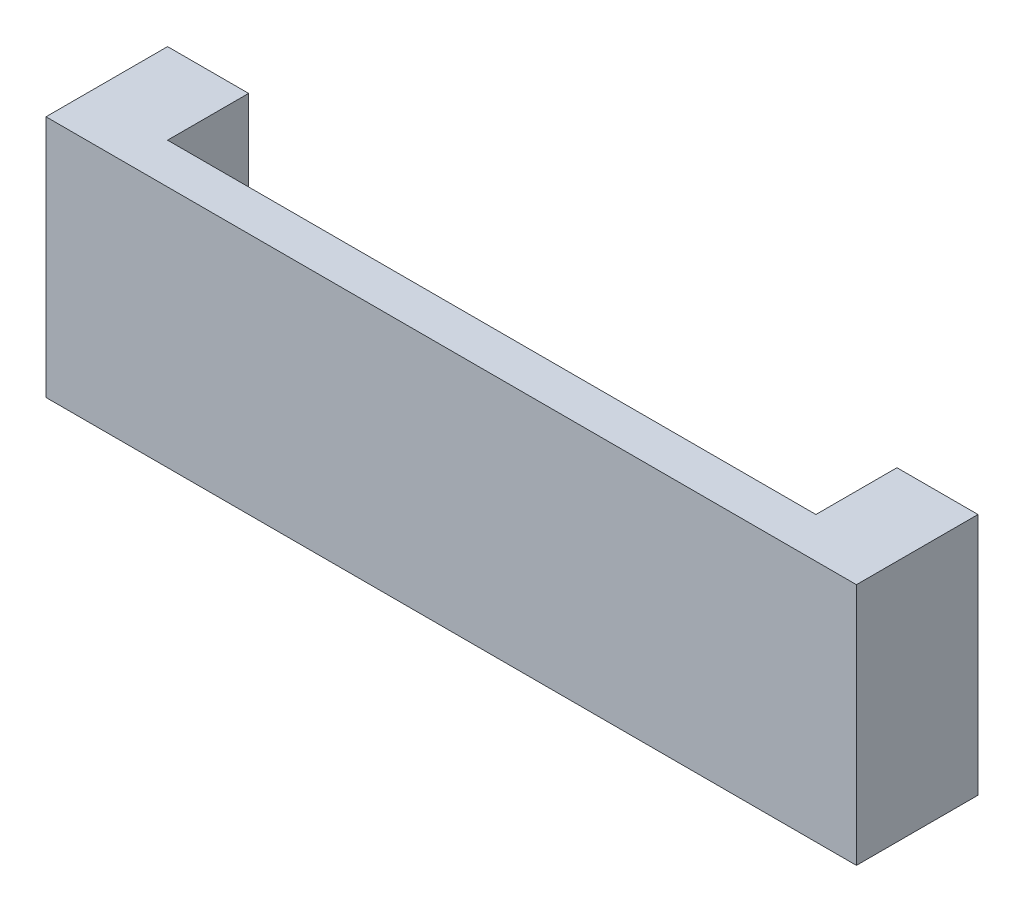
from build123d import *

# Parameters (mm, degrees)
BOSS_EXTRUDE1_DEPTH = 30


with BuildPart() as part:
    # Sketch1 → Boss-Extrude1 (new body)
    with BuildSketch(Plane(origin=(0, 0, 0), x_dir=(1, 0, 0), z_dir=(0, 1, 0))):
        Polygon((-50, 0), (-40, 0), (-40, -10), (40, -10), (40, 0), (50, 0), (50, -15), (-50, -15), align=None)
    extrude(amount=BOSS_EXTRUDE1_DEPTH)


solid = part.part
